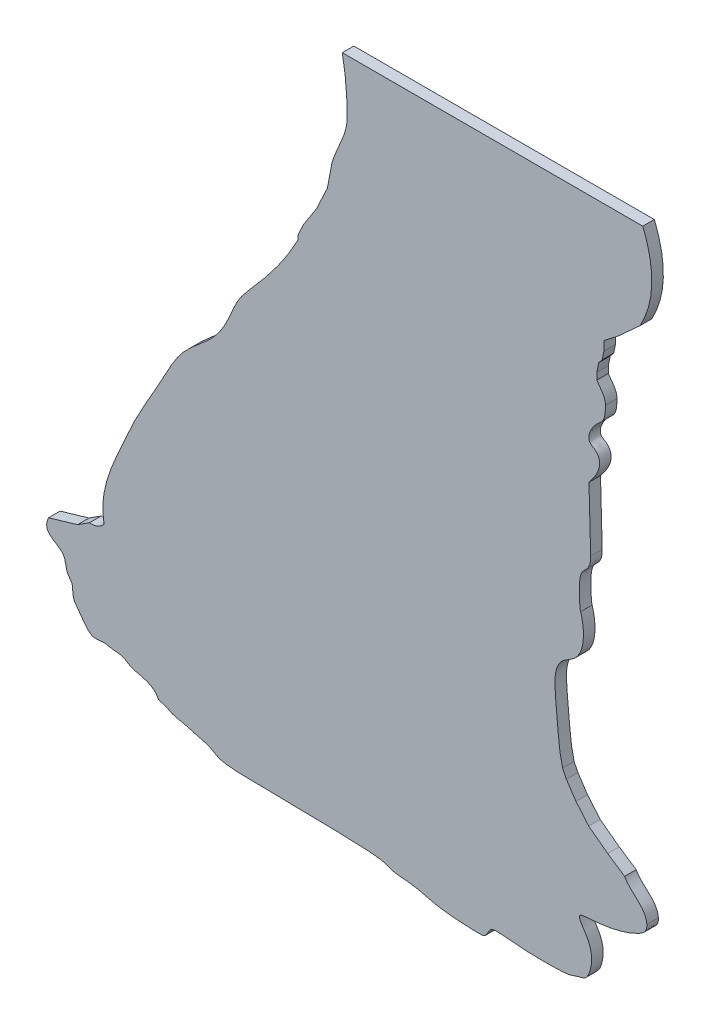
from build123d import *

# Parameters (mm, degrees)
BOSS_EXTRUDE2_DEPTH = 3.175


with BuildPart() as part:
    # Sketch1 → Boss-Extrude2 (new body)
    with BuildSketch(Plane.XY):
        with BuildLine():
            Line((167.202192931, 42.201207676), (162.551708352, 45.309526764))
            Line((162.551708352, 45.309526764), (157.314695785, 49.223337881))
            Line((157.314695785, 49.223337881), (153.792941224, 53.393644073))
            Line((153.792941224, 53.393644073), (151.178747268, 57.312700692))
            Line((151.178747268, 57.312700692), (150.112611404, 59.463302564))
            add(Edge.make_bspline(
                [(150.112611404, 59.463302564), (148.956776361, 63.836980097), (148.948583694, 71.439405876), (146.850507307, 84.051422667), (156.469353715, 88.150203705), (156.247504434, 95.51023866), (155.085269681, 99.2555556)],
                knots=[0, 0, 0, 0, 0.30878338, 0.618237109, 0.70440559, 1, 1, 1, 1], degree=3))
            add(Edge.make_bspline(
                [(157.85398611, 113.880538491), (157.856396998, 113.869859914), (157.850620297, 110.688002063), (155.308060719, 109.384630599), (154.418838948, 105.053269567), (154.8695522, 99.483416676), (155.085269681, 99.2555556)],
                knots=[0, 0, 0, 0, 0.124798805, 0.365607846, 0.555267038, 1, 1, 1, 1], degree=3))
            Line((157.85398611, 113.880538491), (157.37548461, 131.229540091))
            add(Edge.make_bspline(
                [(161.892659898, 151.807216677), (161.91251897, 149.031337188), (161.449944322, 147.791607901), (158.445100345, 145.385958906), (156.130886371, 141.380315264), (158.830222147, 140.043511959), (161.648730322, 137.407909117), (159.459654716, 133.727674066), (157.37548461, 131.229540091)],
                knots=[0, 0, 0, 0, 0.190659477, 0.228612673, 0.488802546, 0.534056192, 0.585175937, 1, 1, 1, 1], degree=3))
            add(Edge.make_bspline(
                [(159.534362736, 156.659486678), (160.786697559, 154.839870961), (162.005548182, 153.612430632), (161.892659898, 151.807216677)],
                knots=[0, 0, 0, 0, 1, 1, 1, 1], degree=3))
            Line((159.534362736, 156.659486678), (159.534362736, 158.498026385))
            Line((159.534362736, 158.498026385), (160.082455849, 161.112276627))
            Line((160.082455849, 161.112276627), (161.024283069, 162.24246929))
            Line((161.024283069, 162.24246929), (161.51276424, 164.572387305))
            Line((161.51276424, 164.572387305), (161.51276424, 167.102297744))
            Line((161.51276424, 167.102297744), (165.183542032, 169.901250177))
            Line((165.183542032, 169.901250177), (171.472031107, 175.621746691))
            add(Edge.make_bspline(
                [(172.196352762, 199.687728108), (177.512545782, 186.611864968), (171.472031107, 175.621746691)],
                knots=[0, 0, 0, 1, 1, 1], degree=2))
            Line((172.196352762, 199.687728108), (89.47301913, 199.687728108))
            add(Edge.make_bspline(
                [(89.47301913, 199.687728108), (90.449698127, 194.83749072), (90.825955315, 189.837761557), (90.838257386, 180.280743918), (87.678298822, 176.191377166), (86.590775441, 171.767770411)],
                knots=[0, 0, 0, 0, 0.517811069, 0.520823107, 1, 1, 1, 1], degree=3))
            Line((86.590775441, 171.767770411), (85.388246292, 165.381063893))
            Line((85.388246292, 165.381063893), (82.402306125, 158.982620678))
            Line((82.402306125, 158.982620678), (78.826589302, 153.432528352))
            Line((78.826589302, 153.432528352), (77.30963174, 150.181905003))
            Line((77.30963174, 150.181905003), (77.30963174, 148.972997238))
            add(Edge.make_bspline(
                [(23.904060298, 54.499744977), (22.54196001, 62.044422938), (27.151157223, 71.719882884), (33.171565612, 85.673583344), (39.470341202, 95.744406946), (45.044436084, 107.397118431), (54.154773918, 113.07293548), (58.357878564, 120.674742163), (60.641830631, 126.791490456), (68.416588167, 135.274765788), (73.920776574, 142.489426767), (77.30963174, 148.972997238)],
                knots=[0, 0, 0, 0, 0.194457475, 0.285904466, 0.412663627, 0.517827397, 0.629268786, 0.691338637, 0.750377013, 0.804905464, 1, 1, 1, 1], degree=3))
            add(Edge.make_bspline(
                [(19.90471503, 52.852955749), (22.437142387, 52.608313662), (23.904060298, 54.499744977)],
                knots=[0, 0, 0, 1, 1, 1], degree=2))
            Line((19.90471503, 52.852955749), (16.611136574, 50.735655313))
            Line((16.611136574, 50.735655313), (8.612446038, 48.383099273))
            add(Edge.make_bspline(
                [(8.612446038, 48.383099273), (6.569110394, 43.962826835), (13.647787757, 43.729648821), (13.25353988, 37.991488936), (15.22587651, 36.112808324), (15.244510931, 34.207409749), (15.425694449, 32.409220236), (16.98119857, 30.317149701), (18.454955258, 28.208570124), (20.727276999, 25.608877763), (23.640354073, 26.519579017), (26.378802415, 25.704997487), (29.007712932, 25.794951803), (31.225977748, 24.007852384), (34.946801718, 23.349304233), (38.00066538, 22.222153794), (38.883062856, 20.144990847)],
                knots=[0, 0, 0, 0, 0.185719976, 0.273851295, 0.320038418, 0.350192261, 0.393849297, 0.435550567, 0.514834292, 0.569194905, 0.638873602, 0.687586559, 0.755837415, 0.80106818, 0.86555143, 1, 1, 1, 1], degree=3))
            add(Edge.make_bspline(
                [(38.883062856, 20.144990847), (41.287485761, 19.565633761), (42.345781106, 18.507338416), (45.419877108, 18.154573301), (49.753848521, 16.793907858), (52.777549507, 16.18916766), (54.793350164, 14.828502217), (56.355595674, 14.173367003), (60.135221906, 13.770206872), (61.546282366, 13.770206872), (99.241754657, 13.215861691), (101.285601848, 12.223202762), (103.959367113, 11.297668631), (106.324621001, 11.297668631), (111.569314404, 10.577808752), (115.168613799, 9.24092612), (123.909769472, 8.521066241), (128.023254495, 8.521066241), (128.948788625, 8.726740492), (129.97715988, 10.783483004), (131.005531136, 11.811854259), (139.335338307, 10.783483004), (144.785705962, 10.783483004), (151.984304751, 10.783483004), (154.349558639, 12.120365636), (156.714812527, 12.120365636), (158.154532285, 16.028176407), (158.154532285, 19.318964425), (157.331835281, 21.684218313), (156.40630115, 23.329612322), (153.732535886, 27.134585968), (157.318908473, 27.134585968), (163.062883757, 27.775503981), (167.439245879, 28.924299038), (170.393290311, 30.100446358), (172.854994004, 31.522764048), (173.319982479, 32.589502315), (173.319982479, 33.793001898)],
                knots=[0, 0, 0, 0, 0.028571429, 0.057142857, 0.085714286, 0.114285714, 0.142857143, 0.171428571, 0.2, 0.228571429, 0.257142857, 0.285714286, 0.314285714, 0.342857143, 0.371428571, 0.4, 0.428571429, 0.457142857, 0.485714286, 0.514285714, 0.542857143, 0.571428571, 0.6, 0.628571429, 0.657142857, 0.685714286, 0.714285714, 0.742857143, 0.771428571, 0.8, 0.828571429, 0.857142857, 0.885714286, 0.914285714, 0.942857143, 0.971428571, 1, 1, 1, 1], degree=3))
            add(Edge.make_bspline(
                [(173.319982479, 33.793001898), (173.056351571, 37.626592871), (168.840626644, 39.112234918), (167.202192931, 42.201207676)],
                knots=[0, 0, 0, 0, 1, 1, 1, 1], degree=3))
        make_face()
    extrude(amount=BOSS_EXTRUDE2_DEPTH)


solid = part.part
